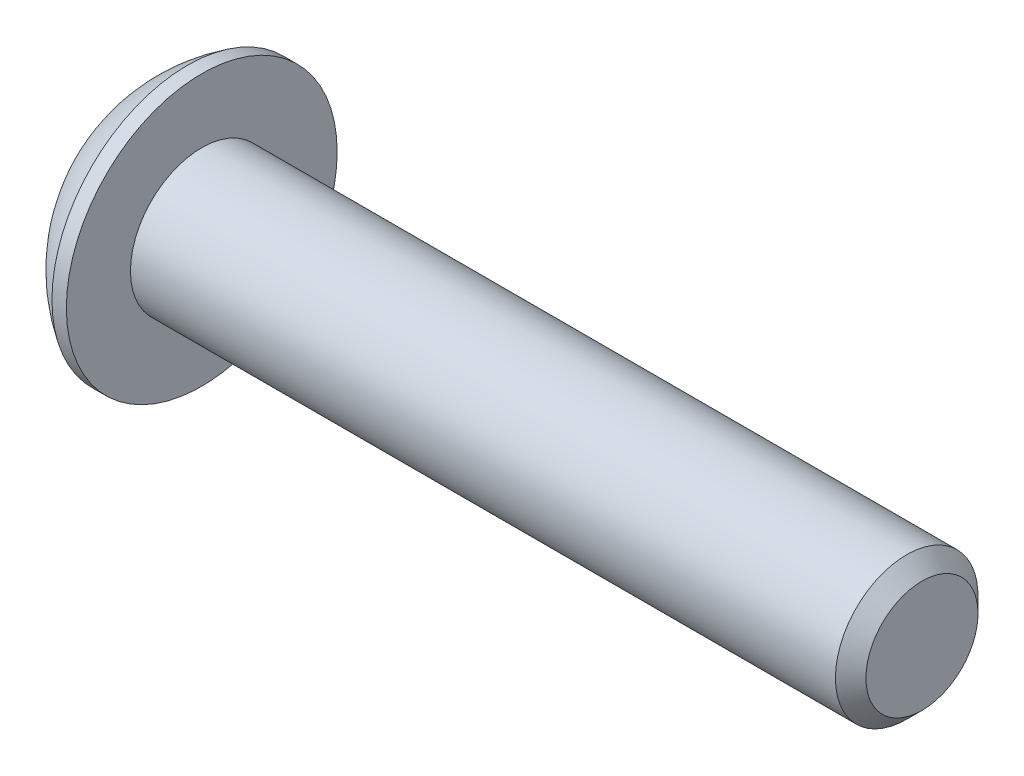
from build123d import *

# Parameters (mm, degrees)
HEX_2_DEPTH = 0.889


with BuildPart() as part:
    # BodySke → BaseBody (revolve)
    with BuildSketch(Plane.XY, mode=Mode.PRIVATE) as basebody_sk:
        with BuildLine():
            Line((14.0208, 0), (14.0208, 0.98806))
            Line((14.0208, 0.98806), (13.75156, 1.2573))
            Line((13.75156, 1.2573), (1.3208, 1.2573))
            Line((1.3208, 1.2573), (1.3208, 2.3876))
            Line((1.3208, 2.3876), (1.0668, 2.3876))
            ThreePointArc((1.0668, 2.3876), (0.446389062, 1.868454455), (0, 1.1938))
            Line((0, 1.1938), (0, 0))
            Line((0, 0), (14.0208, 0))
        make_face()
    revolve(basebody_sk.sketch.rotate(Axis((0, 0, 0), (1, 0, 0)), 90), axis=Axis((0, 0, 0), (1, 0, 0)))

    # Sketch2 → PreBroach (revolve, cut)
    with BuildSketch(Plane.XY, mode=Mode.PRIVATE) as prebroach_sk:
        Polygon((0, 0.7874), (0.889, 0.7874), (1.343605602, 0), (0, 0), align=None)
    revolve(prebroach_sk.sketch.rotate(Axis((0, 0, 0), (1, 0, 0)), 90), axis=Axis((0, 0, 0), (1, 0, 0)), mode=Mode.SUBTRACT)

    # Sketch3 → Hex 2 (cut)
    with BuildSketch(Plane(origin=(0, 0, 0), x_dir=(0, 0, -1), z_dir=(1, 0, 0))):
        Polygon((-0.7874, -0.454605602), (-0.7874, 0.454605602), (0, 0.909211204), (0.7874, 0.454605602), (0.7874, -0.454605602), (0, -0.909211204), align=None)
    extrude(amount=HEX_2_DEPTH, mode=Mode.SUBTRACT)


solid = part.part
